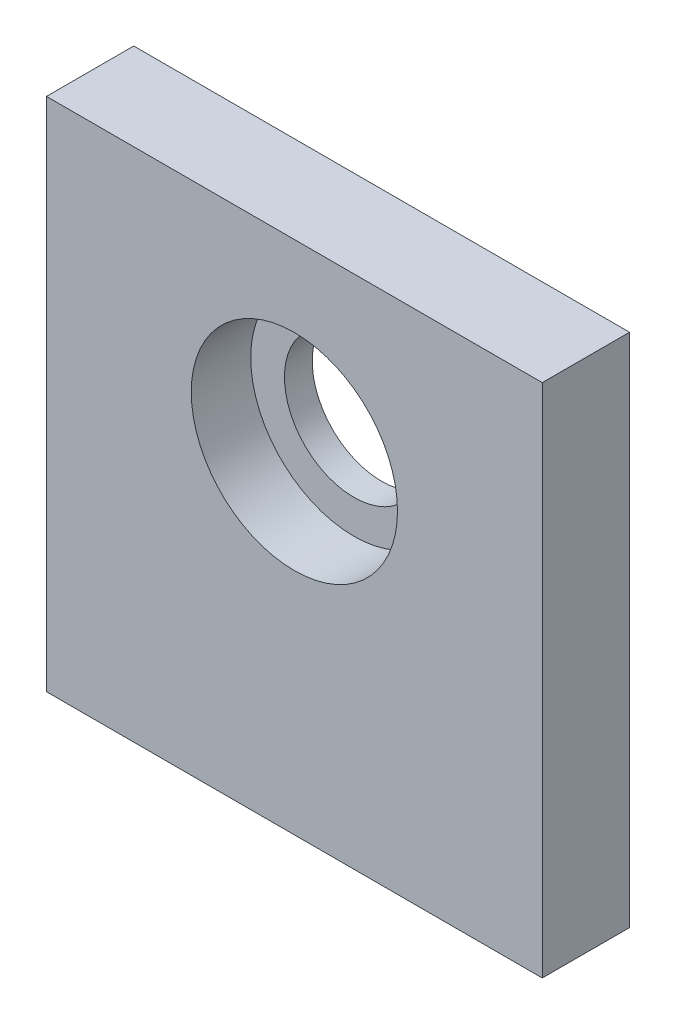
from build123d import *

# Parameters (mm, degrees)
SKETCH1_W                 = 125
SKETCH1_H                 = 130
BOSS_EXTRUDE1_DEPTH       = 22
M5X0_8_TAPPED_HOLE1_D     = 4.2
M5X0_8_TAPPED_HOLE1_DEPTH = 14
M5X0_8_TAPPED_HOLE1_TIP   = 1.2618073


with BuildPart() as part:
    # Sketch1 → Boss-Extrude1 (new body)
    with BuildSketch(Plane.XY):
        with Locations((0, 65)):
            Rectangle(SKETCH1_W, SKETCH1_H)
    extrude(amount=-BOSS_EXTRUDE1_DEPTH)

    # Sketch2 → Cut-Revolve1 (revolve, cut)
    with BuildSketch(Plane(origin=(0, 0, 0), x_dir=(0, 0, -1), z_dir=(1, 0, 0)), mode=Mode.PRIVATE) as cut_revolve1_sk:
        Polygon((0, 109.7), (15, 109.7), (15, 101.2), (22, 101.2), (22, 83.7), (0, 83.7), align=None)
    revolve(cut_revolve1_sk.sketch.rotate(Axis((0, 83.7, 6.088066236), (0, 0, -1)), 90), axis=Axis((0, 83.7, 6.088066236), (0, 0, -1)), mode=Mode.SUBTRACT)

    # M5x0.8 Tapped Hole1
    with Locations(Plane.XZ):
        with Locations((-50, -11), (50, -11)):
            Hole(M5X0_8_TAPPED_HOLE1_D / 2, depth=M5X0_8_TAPPED_HOLE1_DEPTH)
            with Locations((0, 0, -(M5X0_8_TAPPED_HOLE1_DEPTH + M5X0_8_TAPPED_HOLE1_TIP / 2))):  # 118° drill point
                Cone(0, M5X0_8_TAPPED_HOLE1_D / 2, M5X0_8_TAPPED_HOLE1_TIP, mode=Mode.SUBTRACT)


solid = part.part
